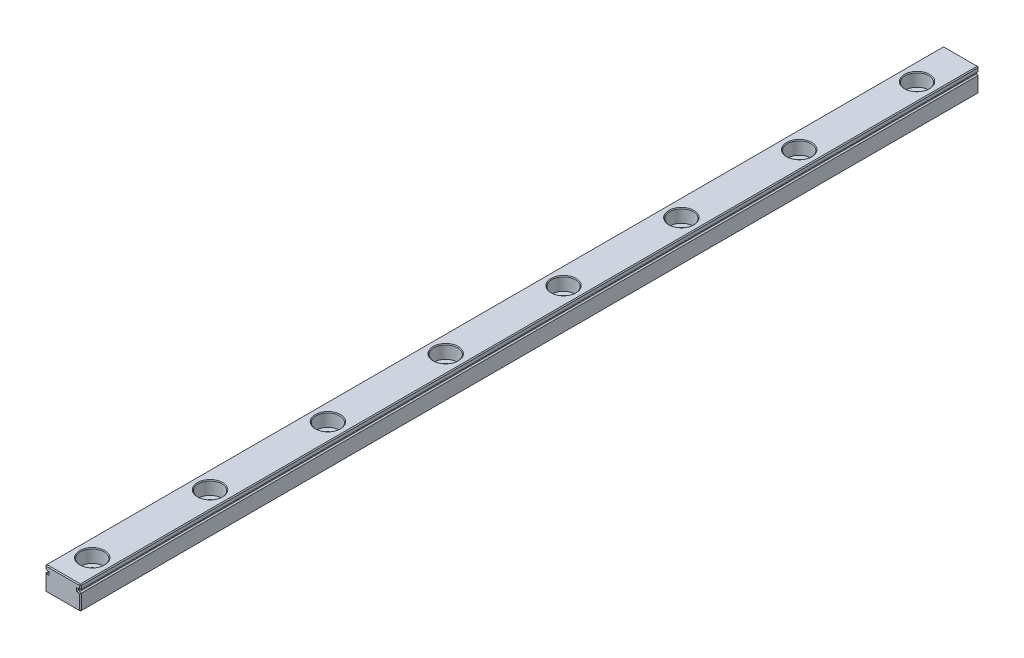
from build123d import *

# Parameters (mm, degrees)
BOSS_EXTRUDE1_DEPTH   = 470
CHAMFER1_SIZE         = 0.3
LPATTERN1_COUNT       = 12
LPATTERN1_PITCH       = 40
CROQUIS1_W            = 18.891255934
CROQUIS1_H            = 12.405534969
CORTAR_EXTRUIR2_DEPTH = 165
CHAFL_N1_SIZE         = 0.3


with BuildPart() as part:
    # Sketch1 → Boss-Extrude1 (new body)
    with BuildSketch(Plane.XY):
        with BuildLine():
            Line((0, 8), (12, 8))
            Line((12, 8), (12, 6.75))
            Line((12, 6.75), (12, 6.559016994))
            ThreePointArc((12, 6.559016994), (11.706107374, 6.475528258), (11.5, 6.25))
            Line((11.5, 6.25), (11, 6.25))
            Line((11, 6.25), (11, 5.75))
            Line((11, 5.75), (11.5, 5.75))
            ThreePointArc((11.5, 5.75), (11.706107374, 5.524471742), (12, 5.440983006))
            Line((12, 5.440983006), (12, 5.25))
            Line((12, 5.25), (12, 0))
            Line((12, 0), (0, 0))
            Line((0, 0), (0, 5.25))
            Line((0, 5.25), (0, 5.440983006))
            ThreePointArc((0, 5.440983006), (0.293892626, 5.524471742), (0.5, 5.75))
            Line((0.5, 5.75), (1, 5.75))
            Line((1, 5.75), (1, 6.25))
            Line((1, 6.25), (0.5, 6.25))
            ThreePointArc((0.5, 6.25), (0.293892626, 6.475528258), (0, 6.559016994))
            Line((0, 6.559016994), (0, 6.75))
            Line((0, 6.75), (0, 8))
        make_face()
    extrude(amount=BOSS_EXTRUDE1_DEPTH)

    # Chamfer1
    chamfer1_edges = [part.edges().sort_by_distance(p)[0] for p in [
        (12, 2.720491503, 470),
        (11.706107374, 5.524471742, 470),
        (0, 2.720491503, 0),
        (0.293892626, 5.524471742, 0),
        (0.75, 5.75, 0),
        (1, 6, 0),
        (0.75, 6.25, 0),
        (11.25, 5.75, 470),
        (0.293892626, 6.475528258, 0),
        (0, 7.279508497, 0),
        (6, 8, 0),
        (12, 7.279508497, 0),
        (11.706107374, 6.475528258, 0),
        (11, 6, 470),
        (11.25, 6.25, 0),
        (11, 6, 0),
        (11.25, 5.75, 0),
        (11.706107374, 5.524471742, 0),
        (12, 2.720491503, 0),
        (6, 0, 0),
        (11.25, 6.25, 470),
        (11.706107374, 6.475528258, 470),
        (12, 7.279508497, 470),
        (0, 8, 235),
        (12, 8, 235),
        (12, 0, 235),
        (0, 0, 235),
        (6, 8, 470),
        (0, 2.720491503, 470),
        (0, 7.279508497, 470),
        (0.293892626, 6.475528258, 470),
        (0.75, 6.25, 470),
        (1, 6, 470),
        (0.75, 5.75, 470),
        (0.293892626, 5.524471742, 470),
        (6, 0, 470),
    ]]
    chamfer(chamfer1_edges, length=CHAMFER1_SIZE)

    # Sketch3 → CBORE for M5 Hex Head Bolt1 (revolve, cut)
    with BuildSketch(Plane(origin=(6, 8, 15), x_dir=(0, 0, 1), z_dir=(1, 0, 0))):
        Polygon((0, 0), (0, 8), (2.5, 8), (2.25, 7.75), (2.25, 4.5), (4, 4.5), (4, 0.25), (4.25, 0), align=None)
    cbore_for_m5_hex_head_bolt1 = revolve(axis=Axis((6, 14.35, 15), (0, -1, 0)), mode=Mode.SUBTRACT)

    # LPattern1: CBORE for M5 Hex Head Bolt1 ×12
    with Locations(*[(0, 0, i * LPATTERN1_PITCH) for i in range(1, LPATTERN1_COUNT)]):
        add(cbore_for_m5_hex_head_bolt1, mode=Mode.SUBTRACT)

    # Croquis1 → Cortar-Extruir2 (cut)
    with BuildSketch(Plane.XY.offset(470)):
        with Locations((5.286012754, 3.624640076)):
            Rectangle(CROQUIS1_W, CROQUIS1_H)
    extrude(amount=-CORTAR_EXTRUIR2_DEPTH, mode=Mode.SUBTRACT)

    # Chaflán1
    chafl_n1_edges = [part.edges().sort_by_distance(p)[0] for p in [
        (0.15, 0.15, 305),
        (11.85, 0.15, 305),
        (0.15, 7.85, 305),
        (11.85, 7.85, 305),
        (12, 2.870491503, 305),
        (11.706107374, 5.524471742, 305),
        (11.25, 5.75, 305),
        (11, 6, 305),
        (11.25, 6.25, 305),
        (11.706107374, 6.475528258, 305),
        (12, 7.129508497, 305),
        (6, 8, 305),
        (0, 7.129508497, 305),
        (0.293892626, 6.475528258, 305),
        (0.75, 6.25, 305),
        (1, 6, 305),
        (0.75, 5.75, 305),
        (0.293892626, 5.524471742, 305),
        (0, 2.870491503, 305),
        (6, 0, 305),
    ]]
    chamfer(chafl_n1_edges, length=CHAFL_N1_SIZE)


solid = part.part
